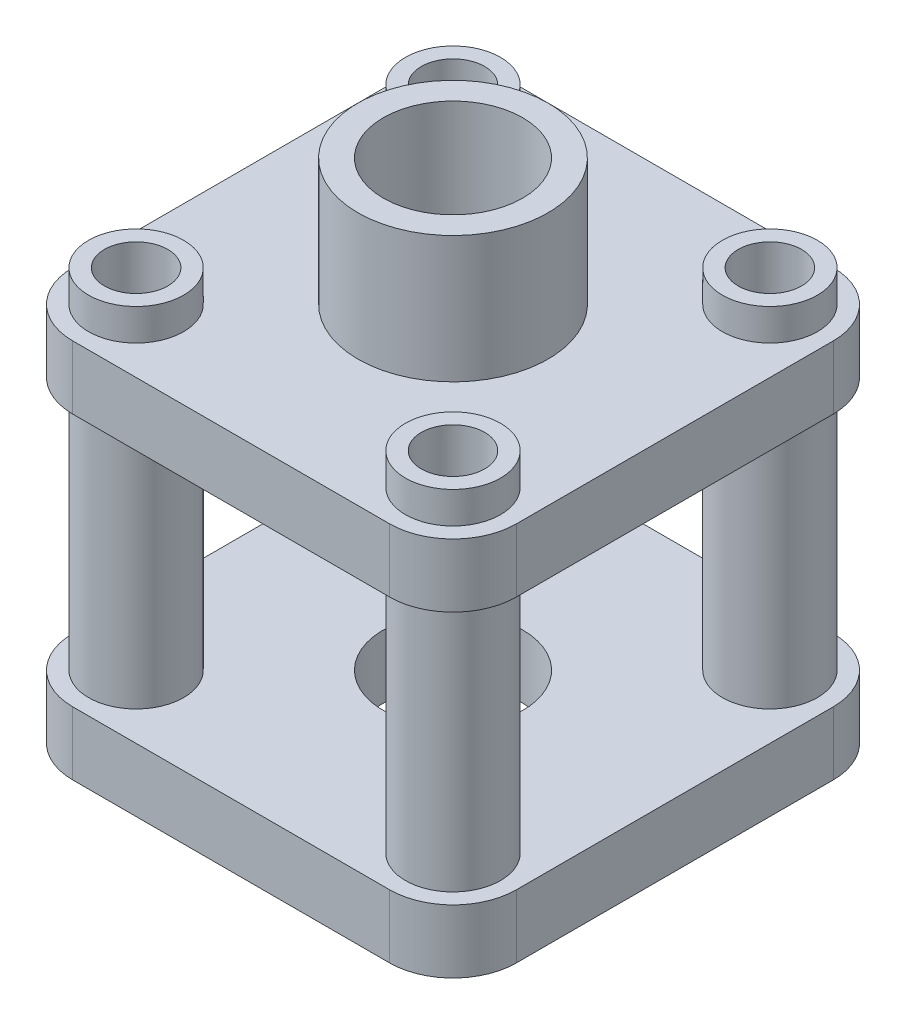
from build123d import *

# Parameters (mm, degrees)
SKETCH1_W                = 70
SKETCH1_H                = 70
BOSS_EXTRUDE1_DEPTH      = 10
LPATTERN2_COUNT          = 2
LPATTERN2_PITCH          = 50
SKETCH2_R                = 15
SKETCH2_R_2              = 11
BOSS_EXTRUDE2_DEPTH      = 20
BOSS_EXTRUDE3_DEPTH      = 5
BOSS_EXTRUDE3_DEPTH_BACK = 55
SKETCH2_3_R              = 7.5
SKETCH2_3_R_2            = 5
CUT_EXTRUDE1_START       = -100
SKETCH3_R                = 5
SKETCH3_R_2              = 11
CUT_EXTRUDE1_DEPTH       = 100
FILLET1_R                = 10


with BuildPart() as part:
    # Sketch1 → Boss-Extrude1 (new body)
    with BuildSketch(Plane(origin=(0, 0, 0), x_dir=(1, 0, 0), z_dir=(0, 1, 0))):
        Rectangle(SKETCH1_W, SKETCH1_H)
    extrude(amount=BOSS_EXTRUDE1_DEPTH)


with BuildPart() as lpattern2_1:
    # LPattern2: pattern copy
    add(part.part.moved(Location(Vector(0, -1, 0) * (1 * LPATTERN2_PITCH))))


with BuildPart() as part_1:
    add(part.part)

    # Sketch2 → Boss-Extrude2 (add)
    with BuildSketch(Plane(origin=(0, 10, 0), x_dir=(1, 0, 0), z_dir=(0, 1, 0))):
        Circle(SKETCH2_R)
        Circle(SKETCH2_R_2, mode=Mode.SUBTRACT)
    extrude(amount=BOSS_EXTRUDE2_DEPTH)

    add(lpattern2_1.part)  # Boss-Extrude3 merges LPattern2_1
    # Sketch2<3> → Boss-Extrude3 (add, two sides: drawn at the far end of the back side and taken through both)
    # profile 1 of 4: a face of its own
    with BuildSketch(Plane(origin=(0, 10, 0), x_dir=(1, 0, 0), z_dir=(0, 1, 0)).offset(-BOSS_EXTRUDE3_DEPTH_BACK)):
        with Locations((25, 25)):
            Circle(SKETCH2_3_R)
        with Locations((25, 25)):
            Circle(SKETCH2_3_R_2, mode=Mode.SUBTRACT)
    # profile 2 of 4: a face of its own
    with BuildSketch(Plane(origin=(0, 10, 0), x_dir=(1, 0, 0), z_dir=(0, 1, 0)).offset(-BOSS_EXTRUDE3_DEPTH_BACK)):
        with Locations((-25, 25)):
            Circle(SKETCH2_3_R)
        with Locations((-25, 25)):
            Circle(SKETCH2_3_R_2, mode=Mode.SUBTRACT)
    # profile 3 of 4: a face of its own
    with BuildSketch(Plane(origin=(0, 10, 0), x_dir=(1, 0, 0), z_dir=(0, 1, 0)).offset(-BOSS_EXTRUDE3_DEPTH_BACK)):
        with Locations((25, -25)):
            Circle(SKETCH2_3_R)
        with Locations((25, -25)):
            Circle(SKETCH2_3_R_2, mode=Mode.SUBTRACT)
    # profile 4 of 4: a face of its own
    with BuildSketch(Plane(origin=(0, 10, 0), x_dir=(1, 0, 0), z_dir=(0, 1, 0)).offset(-BOSS_EXTRUDE3_DEPTH_BACK)):
        with Locations((-25, -25)):
            Circle(SKETCH2_3_R)
        with Locations((-25, -25)):
            Circle(SKETCH2_3_R_2, mode=Mode.SUBTRACT)
    extrude(amount=BOSS_EXTRUDE3_DEPTH + BOSS_EXTRUDE3_DEPTH_BACK)

    # Sketch3 → Cut-Extrude1 (cut)
    with BuildSketch(Plane(origin=(0, 10, 0), x_dir=(1, 0, 0), z_dir=(0, 1, 0)).offset(CUT_EXTRUDE1_START)):
        with Locations((-25, -25)):
            Circle(SKETCH3_R)
        with Locations((-25, 25)):
            Circle(SKETCH3_R)
        with Locations((25, -25)):
            Circle(SKETCH3_R)
        with Locations((25, 25)):
            Circle(SKETCH3_R)
        Circle(SKETCH3_R_2)
    extrude(amount=CUT_EXTRUDE1_DEPTH, mode=Mode.SUBTRACT)

    # Fillet1
    fillet1_edges = [part_1.edges().sort_by_distance(p)[0] for p in [
        (35, -45, 35),
        (35, -45, -35),
        (-35, -45, -35),
        (-35, -45, 35),
        (-35, 5, 35),
        (-35, 5, -35),
        (35, 5, -35),
        (35, 5, 35),
    ]]
    fillet(fillet1_edges, radius=FILLET1_R)


solid = part_1.part
